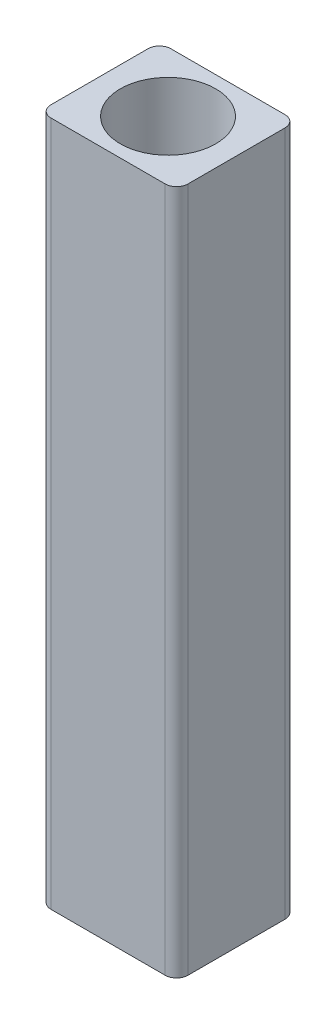
from build123d import *

# Parameters (mm, degrees)
SKETCH1_W           = 6.096
SKETCH1_H           = 5.334
SKETCH1_R           = 2.122
BOSS_EXTRUDE1_DEPTH = 30.48
FILLET1_R           = 0.508


with BuildPart() as part:
    # Sketch1 → Boss-Extrude1 (new body)
    with BuildSketch(Plane(origin=(0, 0, 0), x_dir=(1, 0, 0), z_dir=(0, 1, 0))):
        Rectangle(SKETCH1_W, SKETCH1_H)
        with Locations(Location((0, 0, 0), (0, 0, 90))):
            Circle(SKETCH1_R, mode=Mode.SUBTRACT)
    extrude(amount=BOSS_EXTRUDE1_DEPTH)

    # Fillet1
    fillet1_edges = [part.edges().sort_by_distance(p)[0] for p in [
        (3.048, 15.24, 2.667),
        (-3.048, 15.24, 2.667),
        (-3.048, 15.24, -2.667),
        (3.048, 15.24, -2.667),
    ]]
    fillet(fillet1_edges, radius=FILLET1_R)


solid = part.part
